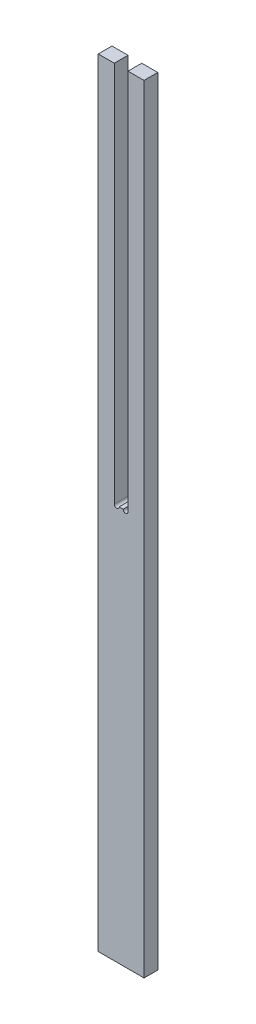
from build123d import *

# Parameters (mm, degrees)
ESTRUSIONE_ESTRUSIONE1_DEPTH = 18


with BuildPart() as part:
    # Schizzo1 → Estrusione-Estrusione1 (new body)
    with BuildSketch(Plane.XY):
        with BuildLine():
            Line((-51.222222222, 843), (-51.222222222, 343))
            ThreePointArc((-51.222222222, 343), (-48.047222222, 339.825), (-44.872222222, 343))
            Line((-44.872222222, 343), (-39.572222222, 343))
            ThreePointArc((-39.572222222, 343), (-36.397222222, 339.825), (-33.222222222, 343))
            Line((-33.222222222, 343), (-33.222222222, 843))
            Line((-33.222222222, 843), (-12.222222222, 843))
            Line((-12.222222222, 843), (-12.222222222, -175))
            Line((-12.222222222, -175), (-72.222222222, -175))
            Line((-72.222222222, -175), (-72.222222222, 843))
            Line((-72.222222222, 843), (-51.222222222, 843))
        make_face()
    extrude(amount=ESTRUSIONE_ESTRUSIONE1_DEPTH)


solid = part.part
